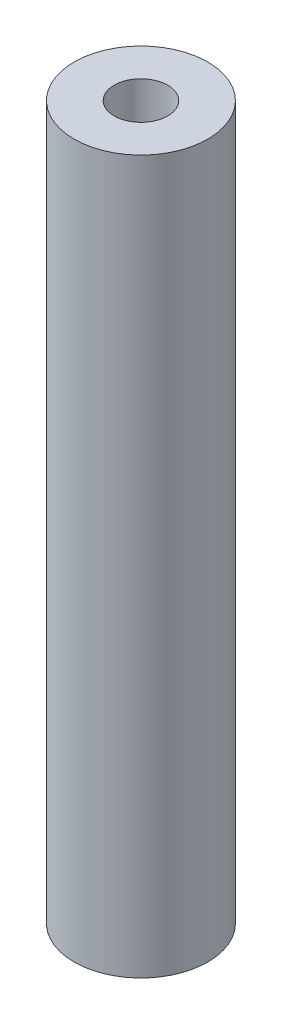
from build123d import *

# Parameters (mm, degrees)
SKETCH_1_R          = 7.5
EXTRUDE_1_DEPTH     = 80
SKETCH_2_R          = 3
CUT_EXTRUDE_1_DEPTH = 20
CUT_EXTRUDE_START   = -20
SKETCH_3_R          = 3
CUT_EXTRUDE_2_DEPTH = 20


with BuildPart() as part:
    # 草图1 → 凸台-拉伸1 (new body)
    with BuildSketch(Plane(origin=(0, 0, 0), x_dir=(1, 0, 0), z_dir=(0, 1, 0))):
        with Locations(Location((0, 0, 0), (0, 0, 270))):
            Circle(SKETCH_1_R)
    extrude(amount=EXTRUDE_1_DEPTH)

    # 草图2 → 切除-拉伸1 (cut)
    with BuildSketch(Plane(origin=(0, 80, 0), x_dir=(1, 0, 0), z_dir=(0, 1, 0))):
        with Locations(Location((0, 0, 0), (0, 0, 270))):
            Circle(SKETCH_2_R)
    extrude(amount=-CUT_EXTRUDE_1_DEPTH, mode=Mode.SUBTRACT)

    # 草图3 → 切除-拉伸2 (cut)
    with BuildSketch(Plane(origin=(0, 0, 0), x_dir=(-1, 0, 0), z_dir=(0, -1, 0)).offset(CUT_EXTRUDE_START)):
        with Locations(Location((0, 0, 0), (0, 0, 270))):
            Circle(SKETCH_3_R)
    extrude(amount=CUT_EXTRUDE_2_DEPTH, mode=Mode.SUBTRACT)


solid = part.part
